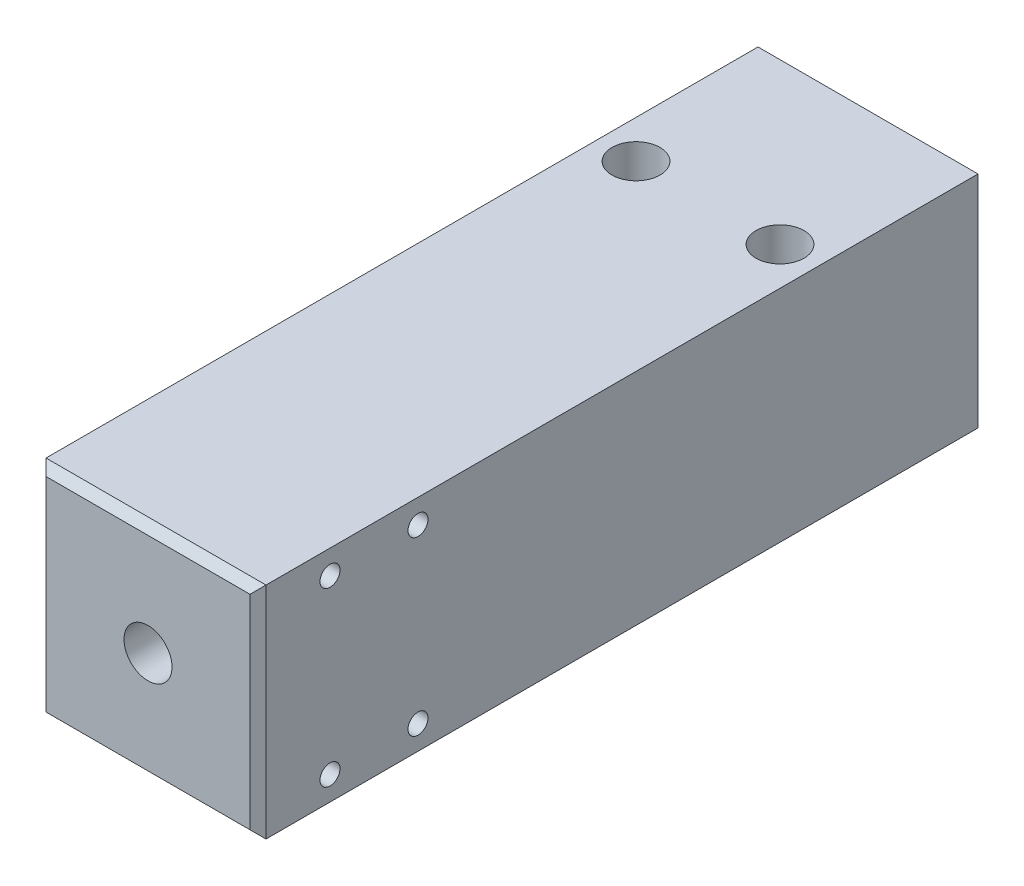
from build123d import *

# Parameters (mm, degrees)
CROQUIS1_W              = 55
CROQUIS1_H              = 55
SALIENTE_EXTRUIR1_DEPTH = 180
CROQUIS2_R              = 6
CORTAR_EXTRUIR1_DEPTH   = 30
CROQUIS3_R              = 4
CORTAR_EXTRUIR2_DEPTH   = 25
CROQUIS4_R              = 2.5
CORTAR_EXTRUIR3_DEPTH   = 15
CORTAR_EXTRUIR4_START   = -15
CROQUIS5_R              = 2.5
CORTAR_EXTRUIR4_DEPTH   = 15
CROQUIS6_R              = 6
CORTAR_EXTRUIR5_DEPTH   = 12
CHAFL_N1_SIZE           = 2


with BuildPart() as part:
    # Croquis1 → Saliente-Extruir1 (new body)
    with BuildSketch(Plane.XY):
        Rectangle(CROQUIS1_W, CROQUIS1_H)
    extrude(amount=-SALIENTE_EXTRUIR1_DEPTH)

    # Croquis2 → Cortar-Extruir1 (cut)
    with BuildSketch(Plane.XY):
        Circle(CROQUIS2_R)
    extrude(amount=-CORTAR_EXTRUIR1_DEPTH, mode=Mode.SUBTRACT)

    # Croquis3 → Cortar-Extruir2 (cut)
    with BuildSketch(Plane(origin=(0, 0, -180), x_dir=(-1, 0, 0), z_dir=(0, 0, -1))):
        with Locations((18, 18)):
            Circle(CROQUIS3_R)
        with Locations((-18, 18)):
            Circle(CROQUIS3_R)
        with Locations((-18, -18)):
            Circle(CROQUIS3_R)
        with Locations((18, -18)):
            Circle(CROQUIS3_R)
    extrude(amount=-CORTAR_EXTRUIR2_DEPTH, mode=Mode.SUBTRACT)

    # Croquis4 → Cortar-Extruir3 (cut)
    with BuildSketch(Plane(origin=(27.5, 0, 0), x_dir=(0, 0, -1), z_dir=(1, 0, 0))):
        with Locations(Location((18, 21.5, 0), (0, 0, 90))):
            Circle(CROQUIS4_R)
        with Locations(Location((40, 21.5, 0), (0, 0, 90))):
            Circle(CROQUIS4_R)
        with Locations(Location((40, -21.5, 0), (0, 0, 90))):
            Circle(CROQUIS4_R)
        with Locations(Location((18, -21.5, 0), (0, 0, 90))):
            Circle(CROQUIS4_R)
    extrude(amount=-CORTAR_EXTRUIR3_DEPTH, mode=Mode.SUBTRACT)

    # Croquis5 → Cortar-Extruir4 (cut)
    with BuildSketch(Plane.ZY.offset(27.5).offset(CORTAR_EXTRUIR4_START)):
        with Locations(Location((-18, 21.5, 0), (0, 0, 90))):
            Circle(CROQUIS5_R)
        with Locations(Location((-40, 21.5, 0), (0, 0, 90))):
            Circle(CROQUIS5_R)
        with Locations(Location((-40, -21.5, 0), (0, 0, 90))):
            Circle(CROQUIS5_R)
        with Locations(Location((-18, -21.5, 0), (0, 0, 90))):
            Circle(CROQUIS5_R)
    extrude(amount=CORTAR_EXTRUIR4_DEPTH, mode=Mode.SUBTRACT)

    # Croquis6 → Cortar-Extruir5 (cut)
    with BuildSketch(Plane(origin=(0, 27.5, 0), x_dir=(1, 0, 0), z_dir=(0, 1, 0))):
        with Locations(Location((-18, 140, 0), (0, 0, 270))):
            Circle(CROQUIS6_R)
        with Locations(Location((18, 140, 0), (0, 0, 270))):
            Circle(CROQUIS6_R)
    extrude(amount=-CORTAR_EXTRUIR5_DEPTH, mode=Mode.SUBTRACT)

    # Chaflán1
    chafl_n1_edges = [part.edges().sort_by_distance(p)[0] for p in [
        (0, -27.5, 0),
        (-27.5, 0, 0),
        (0, 27.5, 0),
        (27.5, 0, 0),
    ]]
    chamfer(chafl_n1_edges, length=CHAFL_N1_SIZE)


solid = part.part
